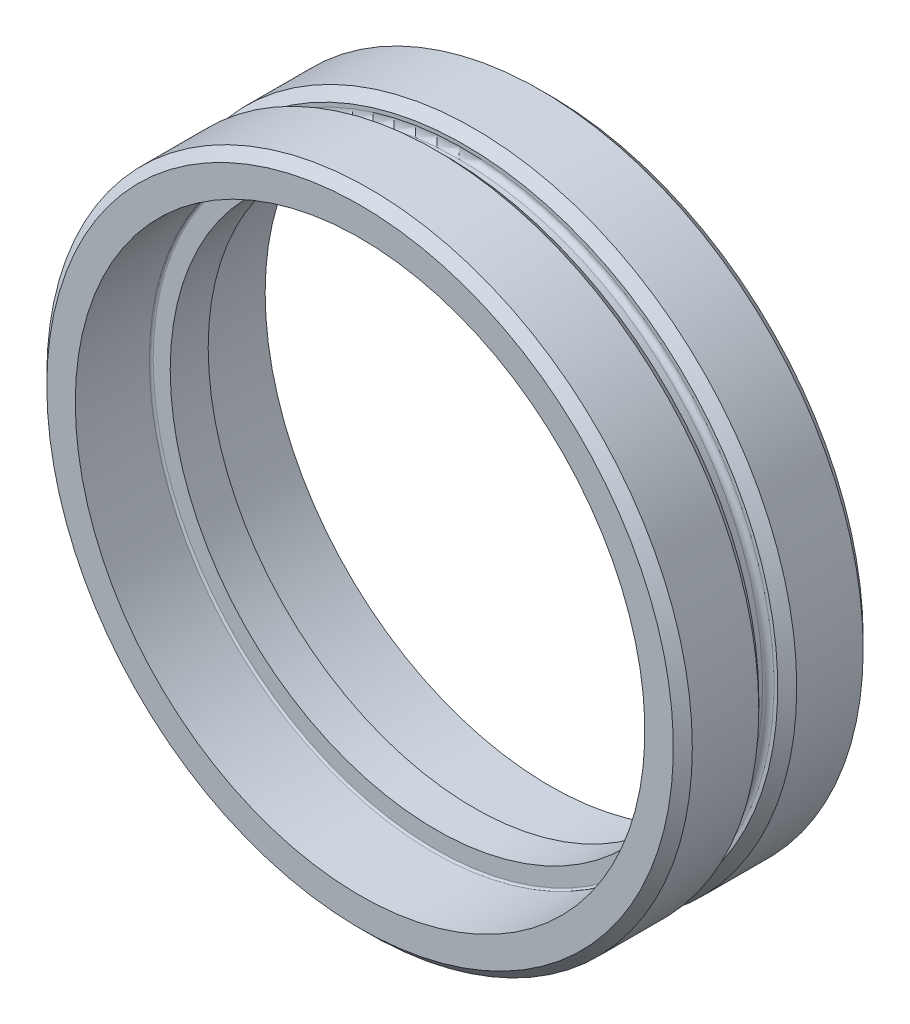
from build123d import *

# Parameters (mm, degrees)
FILLET_1_R     = 0.3
CHAMFER_1_SIZE = 0.5
FILLET_2_R     = 0.1


with BuildPart() as part:
    # Эскиз18 → Повернуть1 (revolve)
    with BuildSketch(Plane(origin=(0, 0, 0), x_dir=(0, 0, -1), z_dir=(1, 0, 0)), mode=Mode.PRIVATE) as revolve_1_sk:
        Polygon((-10, -15), (-6, -15), (-6, -14), (-4, -14), (-4, -15), (0, -15), (0, -17), (-4.5, -17), (-4.5, -16), (-5.5, -16), (-5.5, -17), (-10, -17), align=None)
    revolve(revolve_1_sk.sketch.rotate(Axis((0, 0, 0), (0, 0, 1)), 270), axis=Axis((0, 0, 0), (0, 0, 1)))

    # Скругление1
    fillet_1_edges = [part.edges().sort_by_distance(p)[0] for p in [
        (16, 0, 5.5),
        (16, 0, 4.5),
    ]]
    fillet(fillet_1_edges, radius=FILLET_1_R)

    # Фаска1
    chamfer_1_edges = [part.edges().sort_by_distance(p)[0] for p in [
        (17, 0, 0),
        (17, 0, 10),
        (17, 0, 5.5),
        (17, 0, 4.5),
    ]]
    chamfer(chamfer_1_edges, length=CHAMFER_1_SIZE)

    # Скругление2
    fillet_2_edges = [part.edges().sort_by_distance(p)[0] for p in [
        (15, 0, 4),
        (15, 0, 6),
    ]]
    fillet(fillet_2_edges, radius=FILLET_2_R)


solid = part.part
